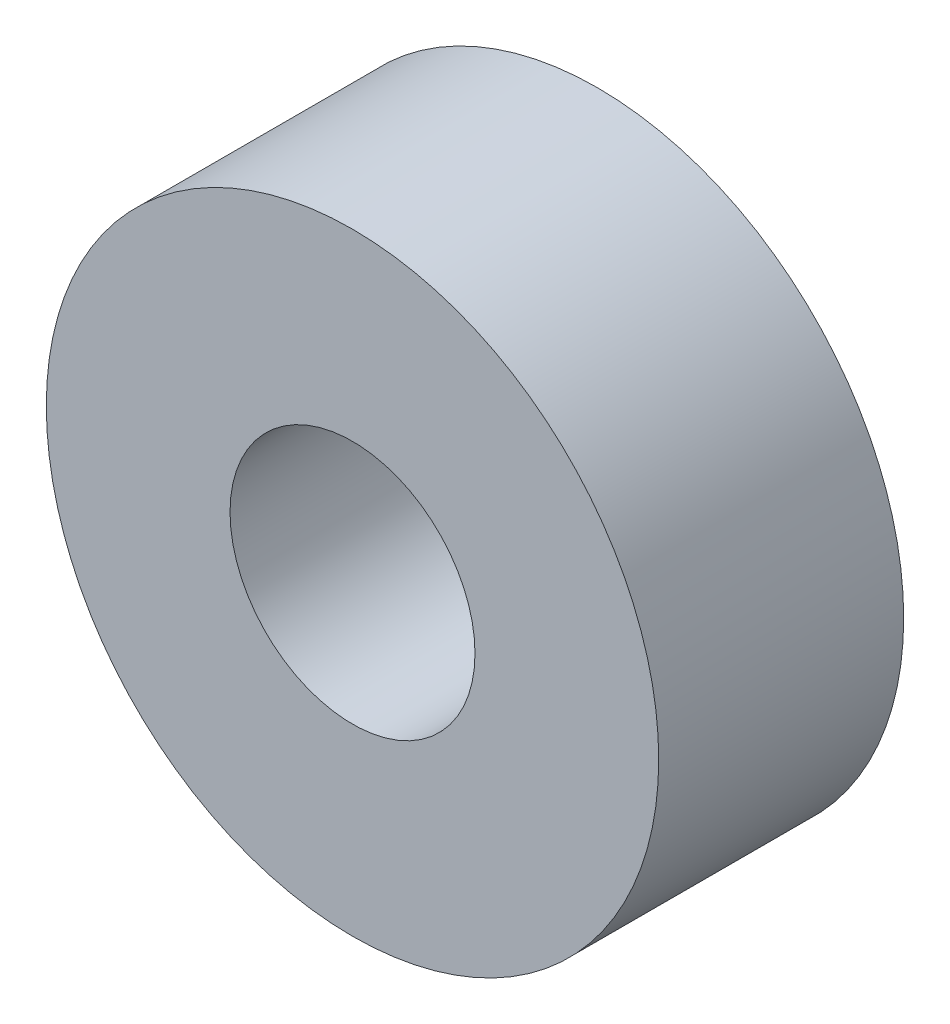
from build123d import *

# Parameters (mm, degrees)
SKETCH1_R           = 2.5
SKETCH1_R_2         = 1
EXTRUDE_THIN1_DEPTH = 2


with BuildPart() as part:
    # Sketch1 → Extrude-Thin1 (new body)
    with BuildSketch(Plane.XY):
        Circle(SKETCH1_R)
        Circle(SKETCH1_R_2, mode=Mode.SUBTRACT)
    extrude(amount=EXTRUDE_THIN1_DEPTH)


solid = part.part
